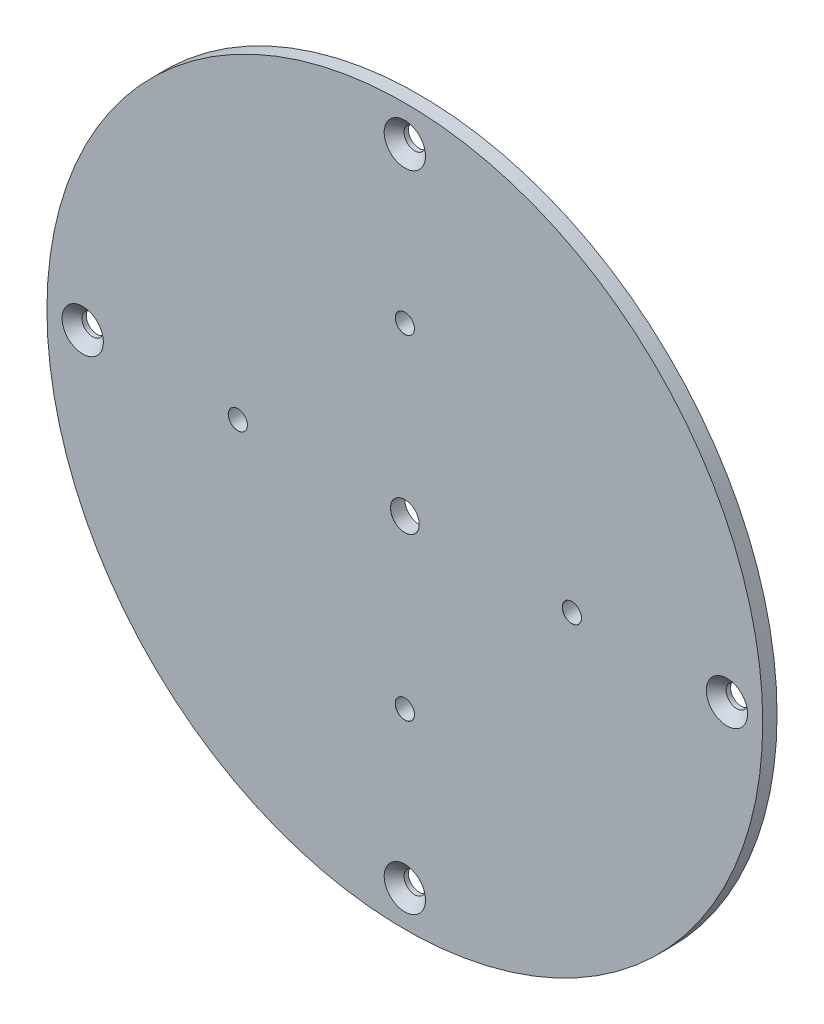
from build123d import *

# Parameters (mm, degrees)
SZKIC1_R                                    = 150
DODANIE_WYCI_GNI_CIE1_DEPTH                 = 6
OTWORY_USTALAJ_CE_8_0MM1_D                  = 8
OTWORY_USTALAJ_CE_8_0MM1_CSINK_D            = 8.05
OTWORY_USTALAJ_CE_8_0MM1_CSINK_ANGLE        = 90
POG_BIENIE_STO_KOWE_POD_M8_WKR_T_DO_2_COUNT = 2
POG_BIENIE_STO_KOWE_POD_M8_WKR_T_DO_2_PITCH = 190.91883092
POG_BIENIE_STO_KOWE_POD_M8_WKR_T_DO_3_COUNT = 2
POG_BIENIE_STO_KOWE_POD_M8_WKR_T_DO_3_PITCH = 270
POG_BIENIE_STO_KOWE_POD_M8_WKR_T_DO_4_COUNT = 2
POG_BIENIE_STO_KOWE_POD_M8_WKR_T_DO_4_PITCH = 190.91883092


with BuildPart() as part:
    # Szkic1 → Dodanie-wyciągnięcie1 (new body)
    with BuildSketch(Plane.XY):
        Circle(SZKIC1_R)
    extrude(amount=DODANIE_WYCI_GNI_CIE1_DEPTH)

    # Otwory ustalające Ø8.0mm1 (through all)
    with Locations(Plane.XY.offset(6)):
        with Locations((0, 70), (0, -70), (-70, 0), (70, 0)):
            CounterSinkHole(OTWORY_USTALAJ_CE_8_0MM1_D / 2, OTWORY_USTALAJ_CE_8_0MM1_CSINK_D / 2, counter_sink_angle=OTWORY_USTALAJ_CE_8_0MM1_CSINK_ANGLE)

    # Szkic6 → Otwory ustalające Ø12.0mm1 (revolve, cut)
    with BuildSketch(Plane(origin=(0, 0, 6), x_dir=(0, -1, 0), z_dir=(1, 0, 0))):
        Polygon((0, 0), (0, 6), (6, 6), (6, 0.025), (6.025, 0), align=None)
    revolve(axis=Axis((0, 0, 12.35), (0, 0, -1)), mode=Mode.SUBTRACT)

    # Szkic10 → Pogłębienie stożkowe pod M8 wkręt do części metalowych z łbem soczewkowym1 (revolve, cut)
    with BuildSketch(Plane(origin=(0, 135, 6), x_dir=(0, -1, 0), z_dir=(1, 0, 0))):
        Polygon((0, 0), (0, 6), (4.5, 6), (4.5, 4.15), (8.65, 0), align=None)
    pog_bienie_sto_kowe_pod_m8_wkr_t_do_cz_c = revolve(axis=Axis((0, 135, 12.35), (0, 0, -1)), mode=Mode.SUBTRACT)

    # Pog_bienie sto_kowe pod M8 wkr_t do  2: Pogłębienie stożkowe pod M8 wkręt do części metalowych z łbem soczewkowym1 ×2
    with Locations(*[Vector(0.7071067811865674, -0.7071067811865276, 0) * (i * POG_BIENIE_STO_KOWE_POD_M8_WKR_T_DO_2_PITCH) for i in range(1, POG_BIENIE_STO_KOWE_POD_M8_WKR_T_DO_2_COUNT)]):
        add(pog_bienie_sto_kowe_pod_m8_wkr_t_do_cz_c, mode=Mode.SUBTRACT)

    # Pog_bienie sto_kowe pod M8 wkr_t do  3: Pogłębienie stożkowe pod M8 wkręt do części metalowych z łbem soczewkowym1 ×2
    with Locations(*[(0, -i * POG_BIENIE_STO_KOWE_POD_M8_WKR_T_DO_3_PITCH, 0) for i in range(1, POG_BIENIE_STO_KOWE_POD_M8_WKR_T_DO_3_COUNT)]):
        add(pog_bienie_sto_kowe_pod_m8_wkr_t_do_cz_c, mode=Mode.SUBTRACT)

    # Pog_bienie sto_kowe pod M8 wkr_t do  4: Pogłębienie stożkowe pod M8 wkręt do części metalowych z łbem soczewkowym1 ×2
    with Locations(*[Vector(-0.7071067811865277, -0.7071067811865674, 0) * (i * POG_BIENIE_STO_KOWE_POD_M8_WKR_T_DO_4_PITCH) for i in range(1, POG_BIENIE_STO_KOWE_POD_M8_WKR_T_DO_4_COUNT)]):
        add(pog_bienie_sto_kowe_pod_m8_wkr_t_do_cz_c, mode=Mode.SUBTRACT)


solid = part.part
